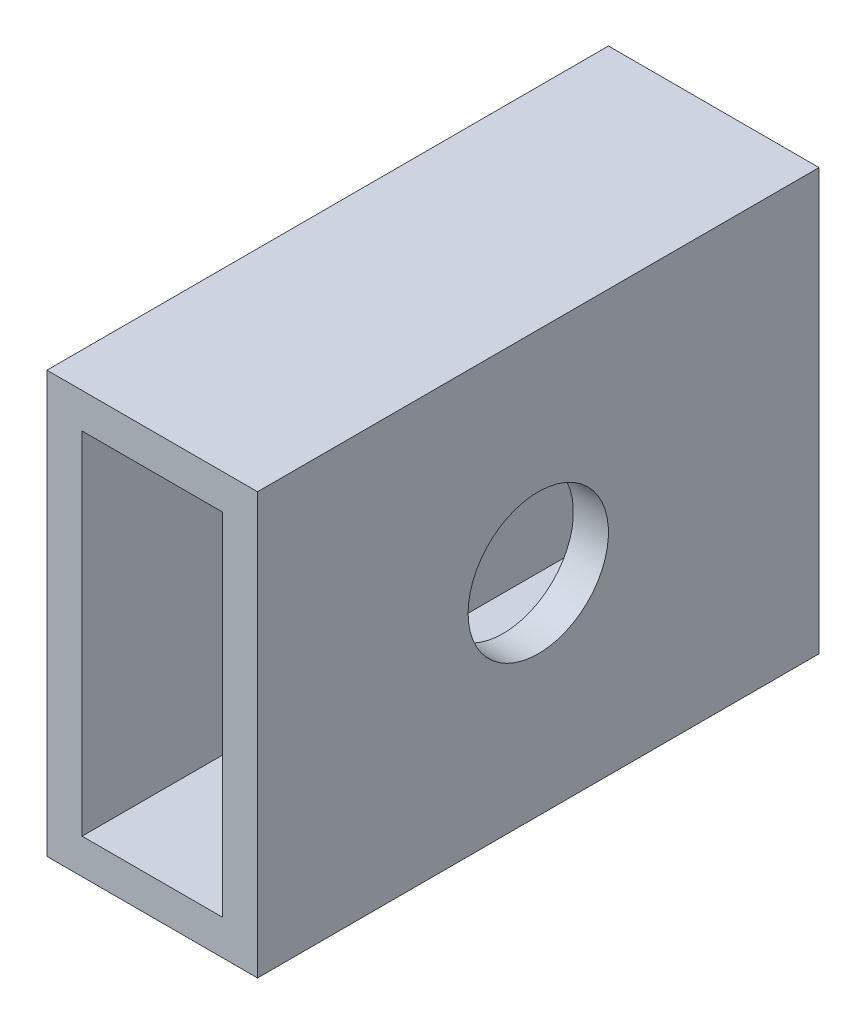
from build123d import *

# Parameters (mm, degrees)
SKETCH1_W           = 19.05
SKETCH1_H           = 38.1
SKETCH1_W_2         = 12.7
SKETCH1_H_2         = 31.75
EXTRUDE_THIN1_DEPTH = 50.8
SKETCH3_R           = 6.35
CUT_EXTRUDE2_DEPTH  = 67.295946332


with BuildPart() as part:
    # Sketch1 → Extrude-Thin1 (new body)
    with BuildSketch(Plane.XY):
        with Locations((9.525, 19.05)):
            Rectangle(SKETCH1_W, SKETCH1_H)
        with Locations((9.525, 19.05)):
            Rectangle(SKETCH1_W_2, SKETCH1_H_2, mode=Mode.SUBTRACT)
    extrude(amount=EXTRUDE_THIN1_DEPTH)

    # Sketch3 → Cut-Extrude2 (cut, through all)
    with BuildSketch(Plane.ZY):
        with Locations((25.4, 19.05)):
            Circle(SKETCH3_R)
    extrude(amount=-CUT_EXTRUDE2_DEPTH, mode=Mode.SUBTRACT)


solid = part.part
